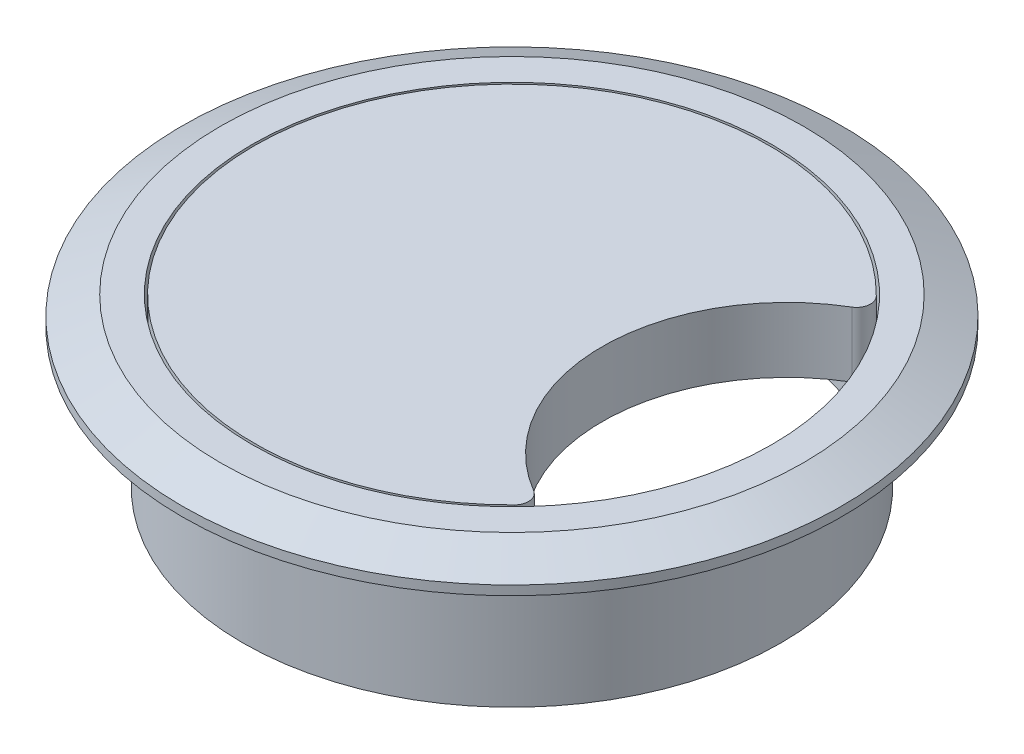
from build123d import *
from build123d.topology import SkipClean

# Parameters (mm, degrees)
SKETCH_1_R      = 35.5
SKETCH_1_R_2    = 28
EXTRUDE_1_DEPTH = 3
CHAMFER_1_SIZE  = 2
CHAMFER_1_SIZE2 = 4.100607683
EXTRUDE_START   = 15
SKETCH_2_R      = 29
SKETCH_2_R_2    = 28
EXTRUDE_2_DEPTH = 15
EXTRUDE_3_DEPTH = 7
FILLET_1_R      = 1.5


with BuildPart() as part:
    # Эскиз1 → Бобышка-Вытянуть1 (new body)
    with BuildSketch(Plane(origin=(0, 0, 0), x_dir=(1, 0, 0), z_dir=(0, 1, 0))):
        with Locations(Location((0, 0, 0), (0, 0, 270))):
            Circle(SKETCH_1_R)
        with Locations(Location((0, 0, 0), (0, 0, 270))):
            Circle(SKETCH_1_R_2, mode=Mode.SUBTRACT)
    extrude(amount=EXTRUDE_1_DEPTH)

    # Фаска1
    chamfer_1_edges = [part.edges().sort_by_distance(p)[0] for p in [
        (0, 3, -35.5),
    ]]
    chamfer_1_side = [part.faces().sort_by_distance(p)[0] for p in [
        (0, 1.5, -35.5),
    ]]
    chamfer(chamfer_1_edges, length=CHAMFER_1_SIZE, length2=CHAMFER_1_SIZE2, reference=chamfer_1_side[0])

    # Эскиз2 → Бобышка-Вытянуть2 (add)
    with SkipClean():  # the faces are left unmerged after this step: merging them gives an invalid solid
        with BuildSketch(Plane.XZ.offset(EXTRUDE_START)):
            with Locations(Location((0, 0, 0), (0, 0, 90))):
                Circle(SKETCH_2_R)
            with Locations(Location((0, 0, 0), (0, 0, 270))):
                Circle(SKETCH_2_R_2, mode=Mode.SUBTRACT)
        extrude(amount=-EXTRUDE_2_DEPTH)


with BuildPart() as body_2:
    # Эскиз3 → Бобышка-Вытянуть3 (new body)
    with BuildSketch(Plane(origin=(0, 3, 0), x_dir=(1, 0, 0), z_dir=(0, 1, 0))):
        with BuildLine():
            ThreePointArc((21.119202458, 18.008976017), (-27.755070341, 0), (21.119202458, -18.008976017))
            ThreePointArc((21.119202458, -18.008976017), (9.717600244, 0), (21.119202458, 18.008976017))
        make_face()
    extrude(amount=-EXTRUDE_3_DEPTH)

    # Скругление1
    fillet_1_edges = [body_2.edges().sort_by_distance(p)[0] for p in [
        (21.119202458, -0.5, 18.008976017),
        (21.119202458, -0.5, -18.008976017),
    ]]
    fillet(fillet_1_edges, radius=FILLET_1_R)


solid = Compound([part.part, body_2.part])
